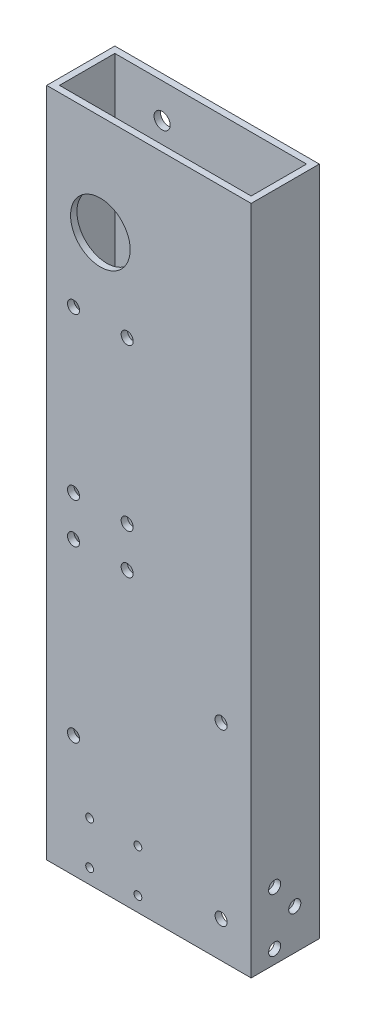
from build123d import *

# Parameters (mm, degrees)
SKETCH1_W                      = 152.4
SKETCH1_H                      = 50.8
SKETCH1_W_2                    = 142.875
SKETCH1_H_2                    = 41.275
EXTRUDE_THIN1_DEPTH            = 500
M8_CLEARANCE_HOLE1_D           = 9
M8_CLEARANCE_HOLE2_D           = 9
F_12_0_12_DIAMETER_HOLE1_D     = 12
F_12_0_12_DIAMETER_HOLE1_DEPTH = 4.7625
CUT_EXTRUDE1_DEPTH             = 507.41050542
CUT_EXTRUDE1_DEPTH_BACK        = 507.41050542
SKETCH9_R                      = 22.225
M5_CLEARANCE_HOLE1_D           = 5.8
M8_CLEARANCE_HOLE3_D           = 9
M8_CLEARANCE_HOLE3_DEPTH       = 4.7625
F_20_0_20_DIAMETER_HOLE1_D     = 20
F_20_0_20_DIAMETER_HOLE1_DEPTH = 4.7625


with BuildPart() as part:
    # Sketch1 → Extrude-Thin1 (new body)
    with BuildSketch(Plane(origin=(0, 0, 0), x_dir=(1, 0, 0), z_dir=(0, 1, 0))):
        Rectangle(SKETCH1_W, SKETCH1_H)
        Rectangle(SKETCH1_W_2, SKETCH1_H_2, mode=Mode.SUBTRACT)
    extrude(amount=EXTRUDE_THIN1_DEPTH)

    # M8 Clearance Hole1 (through all)
    with Locations(Plane.XY.offset(25.4)):
        with Locations((53.8, 153.666666667), (-56.2, 217), (-16.2, 217), (-56.2, 90.333333333), (53.8, 27)):
            Hole(M8_CLEARANCE_HOLE1_D / 2)

    # M8 Clearance Hole2 (through all)
    with Locations(Plane.XY.offset(25.4)):
        with Locations((-56.2, 367), (-16.2, 247), (-56.2, 247), (-16.2, 367)):
            Hole(M8_CLEARANCE_HOLE2_D / 2)

    # Ø12.0 (12) Diameter Hole1
    with Locations(Plane(origin=(0, 0, -25.4), x_dir=(-1, 0, 0), z_dir=(0, 0, -1))):
        with Locations((36.2, 375.7875), (-13.0125, 425), (36.2, 474.2125)):
            Hole(F_12_0_12_DIAMETER_HOLE1_D / 2, depth=F_12_0_12_DIAMETER_HOLE1_DEPTH)

    # Sketch9 → Cut-Extrude1 (cut, two sides: drawn at the far end of the back side and taken through both)
    with BuildSketch(Plane.XY.offset(-CUT_EXTRUDE1_DEPTH_BACK)):
        with Locations((-36.2, 425)):
            Circle(SKETCH9_R)
    extrude(amount=CUT_EXTRUDE1_DEPTH + CUT_EXTRUDE1_DEPTH_BACK, mode=Mode.SUBTRACT)

    # M5 Clearance Hole1 (through all)
    with Locations(Plane.XY.offset(25.4)):
        with Locations((-44.2, 11), (-8.2, 43), (-8.2, 11), (-44.2, 43)):
            Hole(M5_CLEARANCE_HOLE1_D / 2)

    # M8 Clearance Hole3
    with Locations(Plane(origin=(76.2, 0, 0), x_dir=(0, 0, -1), z_dir=(1, 0, 0))):
        with Locations((-7.9, 50), (-7.9, 10), (7.1, 30)):
            Hole(M8_CLEARANCE_HOLE3_D / 2, depth=M8_CLEARANCE_HOLE3_DEPTH)

    # Ø20.0 (20) Diameter Hole1
    with Locations(Plane.ZY.offset(76.2)):
        with Locations((0.4, 40)):
            Hole(F_20_0_20_DIAMETER_HOLE1_D / 2, depth=F_20_0_20_DIAMETER_HOLE1_DEPTH)


solid = part.part
